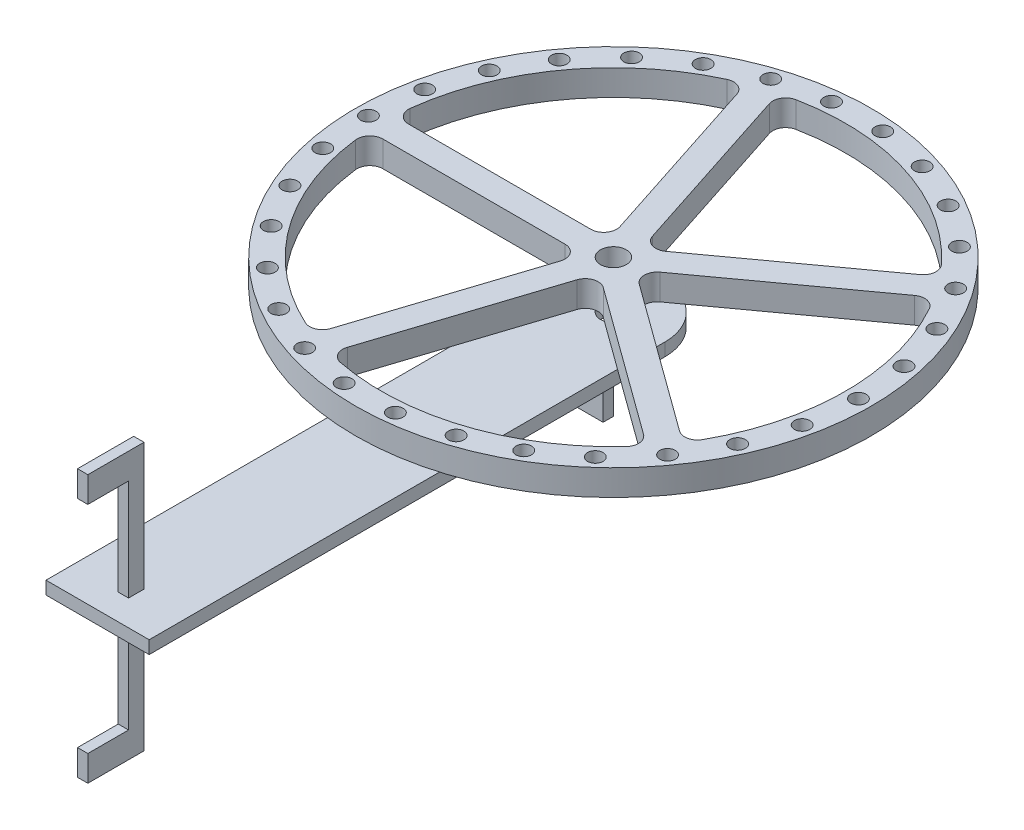
from build123d import *

# Parameters (mm, degrees)
SKETCH1_R           = 50
BOSS_EXTRUDE1_DEPTH = 5
SKETCH4_R           = 2.5
CUT_EXTRUDE1_DEPTH  = 71.887234394
SKETCH7_R           = 1.5
CUT_EXTRUDE2_DEPTH  = 10
CIRPATTERN1_COUNT   = 30
BOSS_EXTRUDE3_DEPTH = 100
SKETCH11_R          = 10
BOSS_EXTRUDE5_DEPTH = 2.5
SKETCH13_R          = 2.5
CUT_EXTRUDE3_DEPTH  = 2.5
BOSS_EXTRUDE6_DEPTH = 10
BOSS_EXTRUDE9_DEPTH = 1


with BuildPart() as part:
    # Sketch1 → Boss-Extrude1 (new body)
    with BuildSketch(Plane(origin=(0, 0, 0), x_dir=(1, 0, 0), z_dir=(0, 1, 0))):
        with Locations(Location((0, 0, 0), (0, 0, 270))):
            Circle(SKETCH1_R)
    extrude(amount=BOSS_EXTRUDE1_DEPTH)

    # Sketch4 → Cut-Extrude1 (cut, through all)
    with BuildSketch(Plane(origin=(0, 5, 0), x_dir=(1, 0, 0), z_dir=(0, 1, 0))):
        with Locations(Location((0, 0, 0), (0, 0, 270))):
            Circle(SKETCH4_R)
        with BuildLine():
            Line((4.098118691, 6.067627458), (32.674983865, 26.829935323))
            ThreePointArc((32.674983865, 26.829935323), (33.693496076, 28.607572328), (33.041139601, 30.549682386))
            ThreePointArc((33.041139601, 30.549682386), (13.905764747, 42.797543233), (-8.774190682, 44.136306799))
            ThreePointArc((-8.774190682, 44.136306799), (-10.443501807, 42.948552273), (-10.664376934, 40.911747269))
            Line((-10.664376934, 40.911747269), (0.25101427, 7.317627458))
            ThreePointArc((0.25101427, 7.317627458), (1.856113075, 5.712528653), (4.098118691, 6.067627458))
        make_face()
        with BuildLine():
            Line((4.098118691, -6.067627458), (32.674983865, -26.829935323))
            ThreePointArc((32.674983865, -26.829935323), (33.693496076, -28.607572328), (33.041139601, -30.549682386))
            ThreePointArc((33.041139601, -30.549682386), (13.905764747, -42.797543233), (-8.774190682, -44.136306799))
            ThreePointArc((-8.774190682, -44.136306799), (-10.443501807, -42.948552273), (-10.664376934, -40.911747269))
            Line((-10.664376934, -40.911747269), (0.25101427, -7.317627458))
            ThreePointArc((0.25101427, -7.317627458), (1.856113075, -5.712528653), (4.098118691, -6.067627458))
        make_face()
        with BuildLine():
            Line((-4.504268312, -5.772542486), (-15.419659516, -39.366662297))
            ThreePointArc((-15.419659516, -39.366662297), (-16.795555191, -40.884645018), (-18.844200854, -40.864362153))
            ThreePointArc((-18.844200854, -40.864362153), (-36.405764747, -26.450336353), (-44.687496219, -5.294117647))
            ThreePointArc((-44.687496219, -5.294117647), (-44.073720044, -3.33947209), (-42.20485754, -2.5))
            Line((-42.20485754, -2.5), (-6.881909602, -2.5))
            ThreePointArc((-6.881909602, -2.5), (-4.859367116, -3.530536869), (-4.504268312, -5.772542486))
        make_face()
        with BuildLine():
            Line((-6.881909602, 2.5), (-42.20485754, 2.5))
            ThreePointArc((-42.20485754, 2.5), (-44.073720044, 3.33947209), (-44.687496219, 5.294117647))
            ThreePointArc((-44.687496219, 5.294117647), (-36.405764747, 26.450336353), (-18.844200854, 40.864362153))
            ThreePointArc((-18.844200854, 40.864362153), (-16.795555191, 40.884645018), (-15.419659516, 39.366662297))
            Line((-15.419659516, 39.366662297), (-4.504268312, 5.772542486))
            ThreePointArc((-4.504268312, 5.772542486), (-4.859367116, 3.530536869), (-6.881909602, 2.5))
        make_face()
        with BuildLine():
            Line((7.037044953, -2.022542486), (35.613910126, -22.784850351))
            ThreePointArc((35.613910126, -22.784850351), (37.619280966, -23.204192983), (39.264748154, -21.983620093))
            ThreePointArc((39.264748154, -21.983620093), (45, 0), (39.264748154, 21.983620093))
            ThreePointArc((39.264748154, 21.983620093), (37.619280966, 23.204192983), (35.613910126, 22.784850351))
            Line((35.613910126, 22.784850351), (7.037044953, 2.022542486))
            ThreePointArc((7.037044953, 2.022542486), (6.006508084, 0), (7.037044953, -2.022542486))
        make_face()
    extrude(amount=-CUT_EXTRUDE1_DEPTH, mode=Mode.SUBTRACT)

    # Sketch7 → Cut-Extrude2 (cut)
    with BuildSketch(Plane(origin=(0, 5, 0), x_dir=(1, 0, 0), z_dir=(0, 1, 0))):
        with Locations(Location((-47.5, 0, 0), (0, 0, 270))):
            Circle(SKETCH7_R)
    cut_extrude2 = extrude(amount=-CUT_EXTRUDE2_DEPTH, mode=Mode.SUBTRACT)

    # CirPattern1: Cut-Extrude2 ×30 about axis
    cirpattern1_axis = Axis((0, 0, 0), (0, 1, 0))
    for i in range(1, CIRPATTERN1_COUNT):
        add(cut_extrude2.rotate(cirpattern1_axis, i * 360 / CIRPATTERN1_COUNT), mode=Mode.SUBTRACT)


with BuildPart() as body_2:
    # Sketch8 → Boss-Extrude3 (new body)
    with BuildSketch(Plane.XY):
        Polygon((0, -4.223266168), (-10, -4.223266168), (-10, -6.723266168), (10, -6.723266168), (10, -4.223266168), align=None)
    extrude(amount=BOSS_EXTRUDE3_DEPTH)

    # Sketch11 → Boss-Extrude5 (add)
    with BuildSketch(Plane.XZ.offset(6.723266168)):
        Circle(SKETCH11_R)
    extrude(amount=-BOSS_EXTRUDE5_DEPTH)

    # Sketch13 → Cut-Extrude3 (cut)
    with BuildSketch(Plane(origin=(0, -4.223266168, 0), x_dir=(1, 0, 0), z_dir=(0, 1, 0))):
        with Locations(Location((0, 0, 0), (0, 0, 270))):
            Circle(SKETCH13_R)
    extrude(amount=-CUT_EXTRUDE3_DEPTH, mode=Mode.SUBTRACT)

    # Sketch14 → Boss-Extrude6 (add)
    with BuildSketch(Plane.XZ.offset(6.723266168)):
        Polygon((0, 5), (5, 5), (5, 7), (-5, 7), (-5, 5), align=None)
    extrude(amount=BOSS_EXTRUDE6_DEPTH)

    # Feet → Boss-Extrude9 (add, symmetric)
    with BuildSketch(Plane(origin=(0, 0, 0), x_dir=(0, 0, -1), z_dir=(1, 0, 0))):
        Polygon((-95, -4.223266168), (-95, 15.433399824), (-102.891455397, 15.433399824), (-102.891455397, 20.433399824), (-92, 20.433399824), (-92, -4.223266168), align=None)
    boss_extrude9 = extrude(amount=BOSS_EXTRUDE9_DEPTH, both=True)

    # Mirror1: Boss-Extrude9 across plane
    add(boss_extrude9.mirror(Plane.ZX.offset(-5.473266168)))


solid = Compound([part.part, body_2.part])
